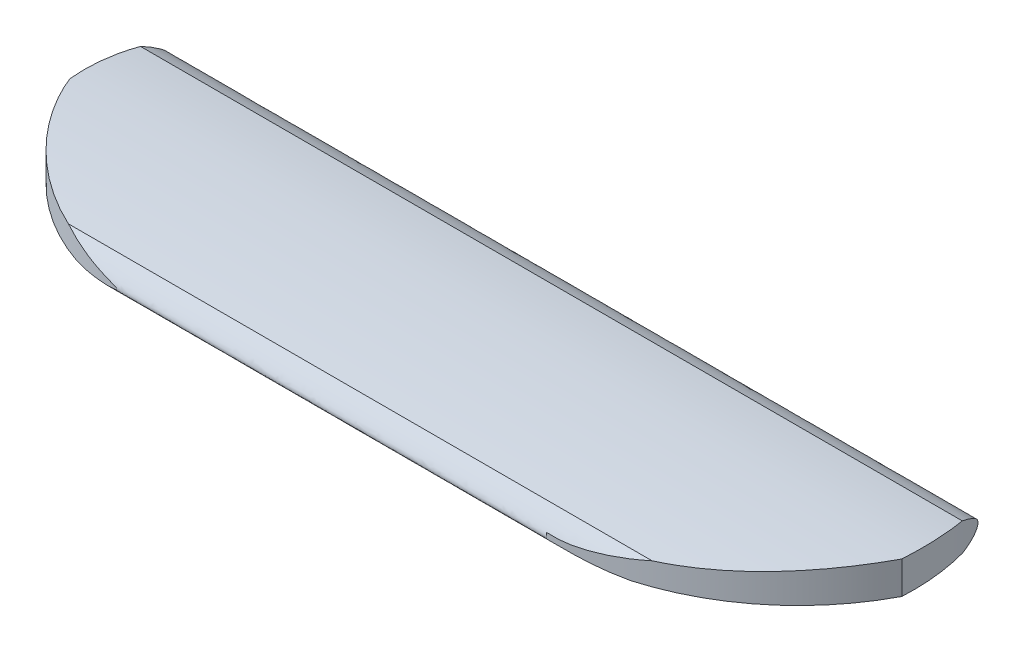
from build123d import *

# Parameters (mm, degrees)
SKETCH1_W                = 250
SKETCH1_H                = 70
BOSS_EXTRUDE1_DEPTH      = 10
CUT_EXTRUDE1_DEPTH       = 10
CUT_EXTRUDE2_DEPTH       = 10
CUT_EXTRUDE7_DEPTH       = 131.083540302
CUT_EXTRUDE7_DEPTH_BACK  = 131.083540302
CUT_EXTRUDE12_DEPTH      = 131.064564638
CUT_EXTRUDE12_DEPTH_BACK = 131.064564638
CUT_EXTRUDE15_DEPTH      = 10
CUT_EXTRUDE16_DEPTH      = 10
CUT_EXTRUDE21_DEPTH      = 131.064564638
CUT_EXTRUDE21_DEPTH_BACK = 131.064564638


with BuildPart() as part:
    # Sketch1 → Boss-Extrude1 (new body)
    with BuildSketch(Plane(origin=(0, 0, 0), x_dir=(1, 0, 0), z_dir=(0, 1, 0))):
        Rectangle(SKETCH1_W, SKETCH1_H)
    extrude(amount=BOSS_EXTRUDE1_DEPTH)

    # Sketch2 → Cut-Extrude1 (cut)
    with BuildSketch(Plane(origin=(0, 10, 0), x_dir=(1, 0, 0), z_dir=(0, 1, 0))):
        with BuildLine():
            Line((-125, -35), (-105.6811507, -35))
            ThreePointArc((-105.6811507, -35), (-123.319359291, -2.181448179), (-120.931126211, 35))
            Line((-120.931126211, 35), (-125, 35))
            Line((-125, 35), (-125, -35))
        make_face()
        with BuildLine():
            ThreePointArc((-102.585198357, -37.985491478), (-104.15687903, -36.517327288), (-105.6811507, -35))
            Line((-105.6811507, -35), (-125, -35))
            Line((-125, -35), (-125, 35))
            Line((-125, 35), (-120.931126211, 35))
            ThreePointArc((-120.931126211, 35), (-117.77369036, 42.419291873), (-113.756908851, 49.410769495))
            ThreePointArc((-113.756908851, 49.410769495), (-123.297106068, 68.789133967), (-141.939517672, 79.697702256))
            ThreePointArc((-141.939517672, 79.697702256), (-176.738011892, 49.445919486), (-154.950429467, 8.808414484))
            ThreePointArc((-154.950429467, 8.808414484), (-179.373061386, -41.265354418), (-129.299292485, -65.687986337))
            ThreePointArc((-129.299292485, -65.687986337), (-103.552743859, -63.784193915), (-102.585198357, -37.985491478))
        make_face()
    extrude(amount=-CUT_EXTRUDE1_DEPTH, mode=Mode.SUBTRACT)

    # Sketch3 → Cut-Extrude2 (cut)
    with BuildSketch(Plane(origin=(0, 10, 0), x_dir=(1, 0, 0), z_dir=(0, 1, 0))):
        with BuildLine():
            ThreePointArc((107.670924145, -35.29278609), (124.046120338, -1.80913671), (119.157389799, 35.142211572))
            ThreePointArc((119.157389799, 35.142211572), (134.08963077, 47.557806696), (153.427471124, 45.778269352))
            ThreePointArc((153.427471124, 45.778269352), (237.062768876, 49.332031087), (168.624576004, 1.127197211))
            ThreePointArc((168.624576004, 1.127197211), (150.729727191, -38.140394783), (107.670924145, -35.29278609))
        make_face()
    extrude(amount=-CUT_EXTRUDE2_DEPTH, mode=Mode.SUBTRACT)

    # Sketch7 → Cut-Extrude7 (cut, two sides: drawn at the far end of the back side and taken through both)
    with BuildSketch(Plane(origin=(0, 0, 0), x_dir=(0, 0, -1), z_dir=(1, 0, 0)).offset(-CUT_EXTRUDE7_DEPTH_BACK)):
        with BuildLine():
            ThreePointArc((33.533398698, 7.292236255), (-1.467141086, 9.688614292), (-36.298819038, 5.501177851))
            ThreePointArc((-36.298819038, 5.501177851), (-59.137780951, 12.031911856), (-75.102753404, 29.621349666))
            ThreePointArc((-75.102753404, 29.621349666), (-94.212515617, 81.478521501), (-38.963674899, 82.862314097))
            ThreePointArc((-38.963674899, 82.862314097), (26.341939645, 119.615559451), (63.095184998, 54.309944906))
            ThreePointArc((63.095184998, 54.309944906), (106.612811455, -5.853362128), (33.533398698, 7.292236255))
        make_face()
    extrude(amount=CUT_EXTRUDE7_DEPTH + CUT_EXTRUDE7_DEPTH_BACK, mode=Mode.SUBTRACT)

    # Sketch8 → Cut-Extrude12 (cut, two sides: drawn at the far end of the back side and taken through both)
    with BuildSketch(Plane(origin=(0, 0, 0), x_dir=(0, 0, -1), z_dir=(1, 0, 0)).offset(-CUT_EXTRUDE12_DEPTH_BACK)):
        with BuildLine():
            Line((-28.066580628, 7.960156192), (-42.709897039, 11.860300813))
            Line((-42.709897039, 11.860300813), (-42.709897039, -7.993078492))
            Line((-42.709897039, -7.993078492), (-28.71193991, -0.466643389))
            add(Edge.make_bspline(
                [(-28.066580628, 7.960156192), (-39.598055898, 0.513916796), (-33.220375755, 0.370849615), (-28.71193991, -0.466643389)],
                knots=[0, 0, 0, 0, 0.838507954, 0.838507954, 0.838507954, 0.838507954], degree=3))
        make_face()
    extrude(amount=CUT_EXTRUDE12_DEPTH + CUT_EXTRUDE12_DEPTH_BACK, mode=Mode.SUBTRACT)

    # Sketch9 → Cut-Extrude15 (cut)
    with BuildSketch(Plane(origin=(0, 0, 0), x_dir=(-1, 0, 0), z_dir=(0, -1, 0))):
        with BuildLine():
            Line((124.655946291, 5.484693498), (146.36395099, -21.002614193))
            Line((146.36395099, -21.002614193), (76.210821695, -48.228862541))
            Line((76.210821695, -48.228862541), (66.423803533, -43.378905656))
            Line((66.423803533, -43.378905656), (70.788178261, -34.57177278))
            ThreePointArc((70.788178261, -34.57177278), (103.40223816, -22.182216373), (124.655946291, 5.484693498))
        make_face()
    extrude(amount=-CUT_EXTRUDE15_DEPTH, mode=Mode.SUBTRACT)

    # Sketch10 → Cut-Extrude16 (cut)
    with BuildSketch(Plane(origin=(0, 0, 0), x_dir=(-1, 0, 0), z_dir=(0, -1, 0))):
        with BuildLine():
            Line((-57.675166137, -34.275423238), (-71.543821122, -47.200540174))
            Line((-71.543821122, -47.200540174), (-140.907758081, -43.326426614))
            Line((-140.907758081, -43.326426614), (-154.2664719, 14.83864241))
            Line((-154.2664719, 14.83864241), (-126.862900993, 9.383026654))
            ThreePointArc((-126.862900993, 9.383026654), (-98.892649646, -22.942974845), (-57.675166137, -34.275423238))
        make_face()
    extrude(amount=-CUT_EXTRUDE16_DEPTH, mode=Mode.SUBTRACT)

    # Sketch11 → Cut-Extrude21 (cut, two sides: drawn at the far end of the back side and taken through both)
    with BuildSketch(Plane(origin=(0, 0, 0), x_dir=(0, 0, -1), z_dir=(1, 0, 0)).offset(-CUT_EXTRUDE21_DEPTH_BACK)):
        with BuildLine():
            Line((25.230837074, 8.500137714), (41.025699478, 16.186384417))
            Line((41.025699478, 16.186384417), (42.557487911, 1.877911824))
            Line((42.557487911, 1.877911824), (37.210923704, -12.479147824))
            Line((37.210923704, -12.479147824), (27.144998545, -6.229370678))
            Line((27.144998545, -6.229370678), (24.539214353, -0.167468362))
            add(Edge.make_bspline(
                [(25.230837074, 8.500137714), (39.968005994, 2.152916652), (24.539214353, -0.167468362)],
                knots=[0, 0, 0, 1, 1, 1], degree=2))
        make_face()
    extrude(amount=CUT_EXTRUDE21_DEPTH + CUT_EXTRUDE21_DEPTH_BACK, mode=Mode.SUBTRACT)


solid = part.part
